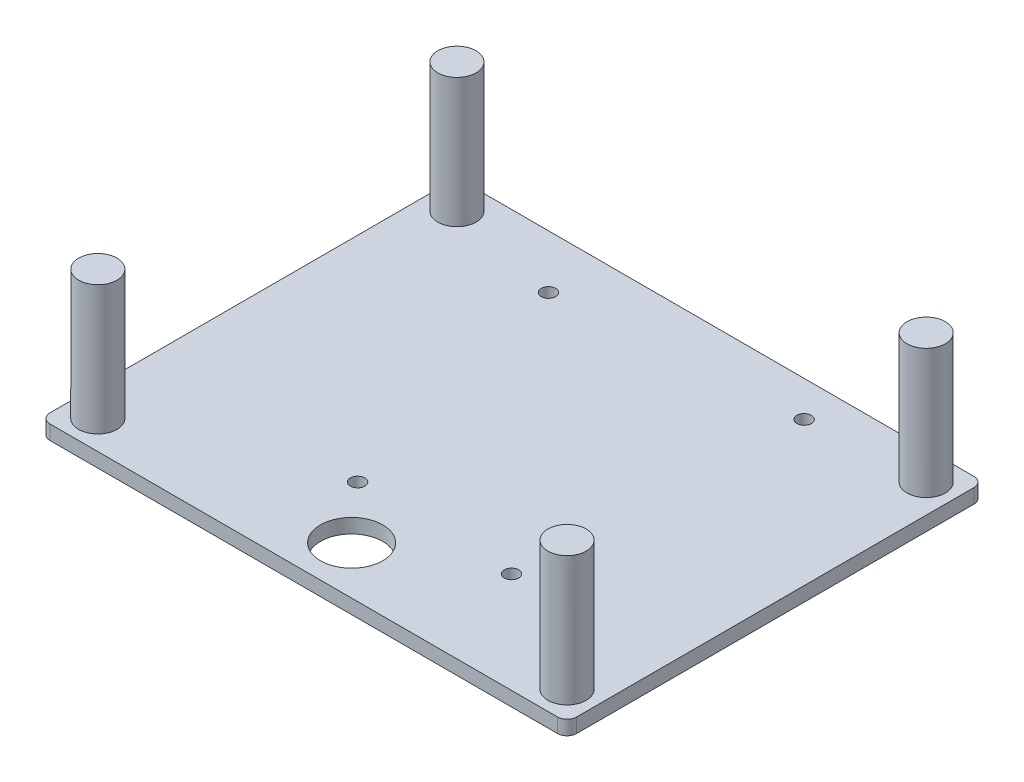
from build123d import *

# Parameters (mm, degrees)
IZIM1_W                     = 110
IZIM1_H                     = 87
Y_KSEKLIK_EKSTR_ZYON1_DEPTH = 3
RADYUS1_R                   = 2
IZIM2_R                     = 4
Y_KSEKLIK_EKSTR_ZYON2_DEPTH = 27
IZIM4_R                     = 6.5
KES_EKSTR_ZYON1_DEPTH       = 13
IZIM5_R                     = 1.5
KES_EKSTR_ZYON2_DEPTH       = 10


with BuildPart() as part:
    # Çizim1 → Yükseklik-Ekstrüzyon1 (new body)
    with BuildSketch(Plane(origin=(0, 0, 0), x_dir=(1, 0, 0), z_dir=(0, 1, 0))):
        Rectangle(IZIM1_W, IZIM1_H)
    extrude(amount=Y_KSEKLIK_EKSTR_ZYON1_DEPTH)

    # Radyus1
    radyus1_edges = [part.edges().sort_by_distance(p)[0] for p in [
        (55, 1.5, 43.5),
        (-55, 1.5, 43.5),
        (-55, 1.5, -43.5),
        (55, 1.5, -43.5),
    ]]
    fillet(radyus1_edges, radius=RADYUS1_R)

    # Çizim2 → Yükseklik-Ekstrüzyon2 (add)
    with BuildSketch(Plane(origin=(0, 3, 0), x_dir=(1, 0, 0), z_dir=(0, 1, 0))):
        with Locations(Location((-49, 37.5, 0), (0, 0, 90))):
            Circle(IZIM2_R)
        with Locations(Location((49, 37.5, 0), (0, 0, 90))):
            Circle(IZIM2_R)
        with Locations(Location((49, -37.5, 0), (0, 0, 90))):
            Circle(IZIM2_R)
        with Locations(Location((-49, -37.5, 0), (0, 0, 90))):
            Circle(IZIM2_R)
    extrude(amount=Y_KSEKLIK_EKSTR_ZYON2_DEPTH)

    # Çizim4 → Kes-Ekstrüzyon1 (cut)
    with BuildSketch(Plane.XZ):
        with Locations(Location((0, 33.5, 0), (0, 0, 270))):
            Circle(IZIM4_R)
    extrude(amount=-KES_EKSTR_ZYON1_DEPTH, mode=Mode.SUBTRACT)

    # Çizim5 → Kes-Ekstrüzyon2 (cut)
    with BuildSketch(Plane(origin=(0, 0, 0), x_dir=(-1, 0, 0), z_dir=(0, -1, 0))):
        with Locations(Location((-22.32, -22.43, 0), (0, 0, 90))):
            Circle(IZIM5_R)
        with Locations(Location((10.36, -21.88, 0), (0, 0, 90))):
            Circle(IZIM5_R)
        with Locations(Location((-24.94, 36.07, 0), (0, 0, 90))):
            Circle(IZIM5_R)
        with Locations(Location((24.72, 32.33, 0), (0, 0, 90))):
            Circle(IZIM5_R)
    extrude(amount=-KES_EKSTR_ZYON2_DEPTH, mode=Mode.SUBTRACT)


solid = part.part
